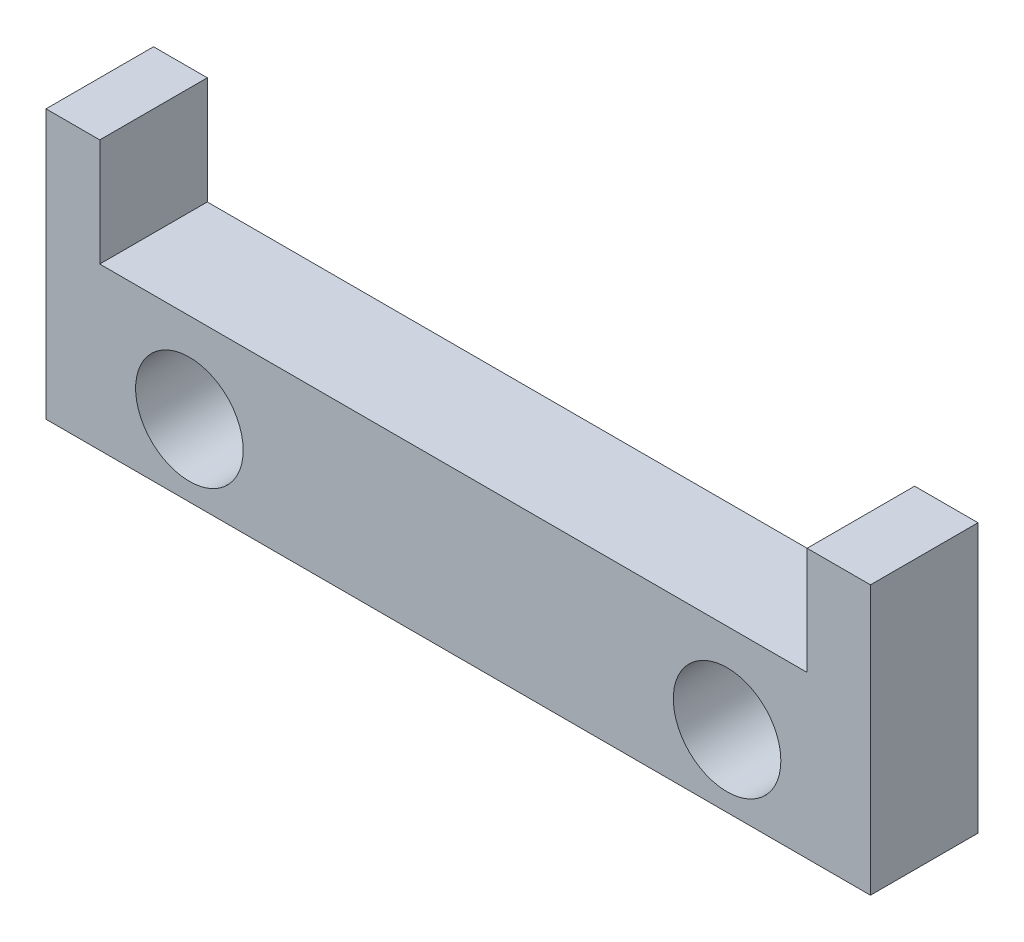
from build123d import *

# Parameters (mm, degrees)
ESQUISSE1_R        = 3
BOSS_EXTRU_1_DEPTH = 6


with BuildPart() as part:
    # Esquisse1 → Boss.-Extru.1 (new body)
    with BuildSketch(Plane.XY):
        Polygon((-23, 0), (23, 0), (23, 15), (19.464603072, 15), (19.464603072, 9), (-20, 9), (-20, 15), (-23, 15), align=None)
        with Locations((-15, 4)):
            Circle(ESQUISSE1_R, mode=Mode.SUBTRACT)
        with Locations((15, 4)):
            Circle(ESQUISSE1_R, mode=Mode.SUBTRACT)
    extrude(amount=BOSS_EXTRU_1_DEPTH)


solid = part.part
